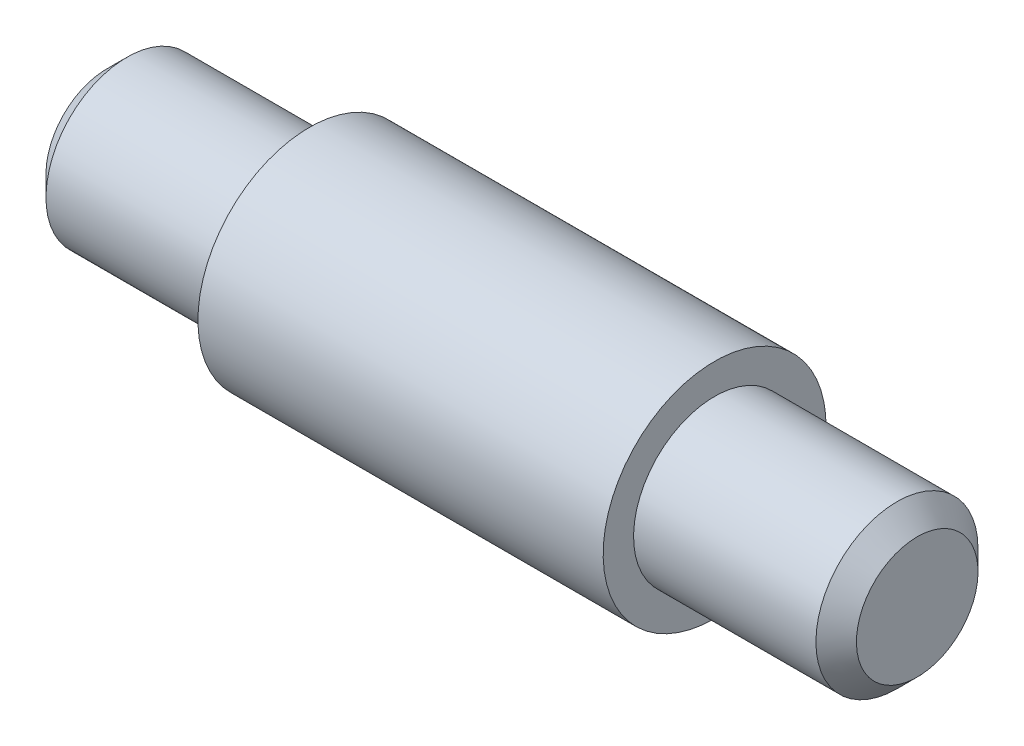
from build123d import *

# Parameters (mm, degrees)
CHANFREIN1_SIZE = 2


with BuildPart() as part:
    # Esquisse1 → Révolution1 (revolve)
    with BuildSketch(Plane.XY):
        Polygon((40, 0), (40, -8), (20, -8), (20, -11), (-20, -11), (-20, -8), (-40, -8), (-40, 0), align=None)
    revolve(axis=Axis((-50, 0, 0), (1, 0, 0)))

    # Chanfrein1
    chanfrein1_edges = [part.edges().sort_by_distance(p)[0] for p in [
        (-40, 8, 0),
        (40, 8, 0),
    ]]
    chamfer(chanfrein1_edges, length=CHANFREIN1_SIZE)


solid = part.part
